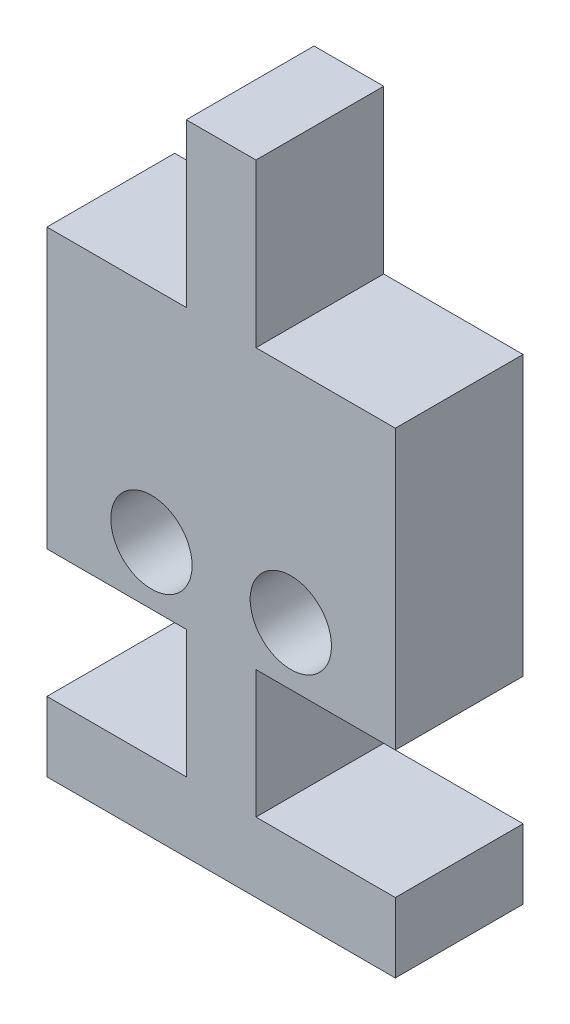
from build123d import *

# Parameters (mm, degrees)
EXTRUDE_1_DEPTH     = 5.5
SKETCH_2_R          = 1.75
CUT_EXTRUDE_1_DEPTH = 30.030156734


with BuildPart() as part:
    # ｽｹｯﾁ1 → ﾎﾞｽ - 押し出し1 (new body)
    with BuildSketch(Plane.XY):
        Polygon((1.5, -7), (7.5, -7), (7.5, -19), (1.5, -19), (1.5, -24.5), (7.5, -24.5), (7.5, -27.5), (-7.5, -27.5), (-7.5, -24.5), (-1.5, -24.5), (-1.5, -19), (-7.5, -19), (-7.5, -7), (-1.5, -7), (-1.5, 0), (1.5, 0), align=None)
    extrude(amount=EXTRUDE_1_DEPTH)

    # ｽｹｯﾁ2 → ｶｯﾄ - 押し出し1 (cut, through all)
    with BuildSketch(Plane.XY.offset(5.5)):
        with Locations((-3, -16.5)):
            Circle(SKETCH_2_R)
        with Locations((3, -16.5)):
            Circle(SKETCH_2_R)
    extrude(amount=-CUT_EXTRUDE_1_DEPTH, mode=Mode.SUBTRACT)


solid = part.part
